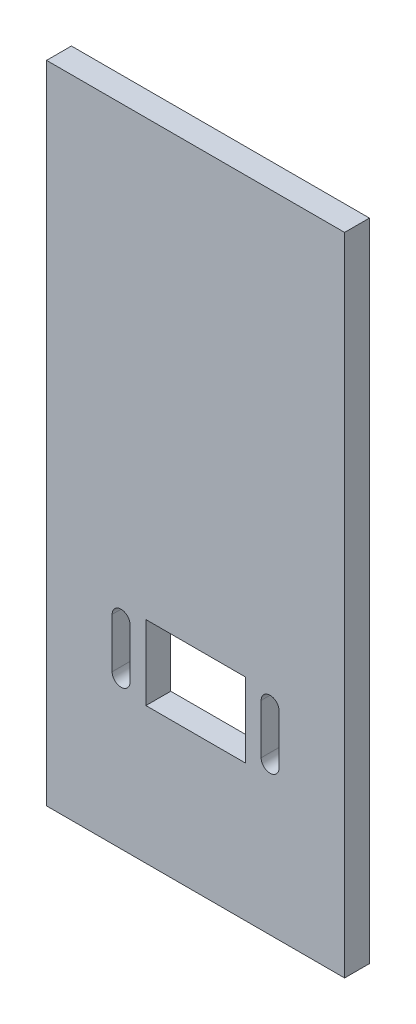
from build123d import *

# Parameters (mm, degrees)
SKETCH1_W           = 60
SKETCH1_H           = 130
BOSS_EXTRUDE1_DEPTH = 5
SKETCH2_W           = 20
SKETCH2_H           = 15
CUT_EXTRUDE1_DEPTH  = 5
CUT_EXTRUDE2_DEPTH  = 5


with BuildPart() as part:
    # Sketch1 → Boss-Extrude1 (new body)
    with BuildSketch(Plane.XY):
        Rectangle(SKETCH1_W, SKETCH1_H)
    extrude(amount=BOSS_EXTRUDE1_DEPTH)

    # Sketch2 → Cut-Extrude1 (cut)
    with BuildSketch(Plane(origin=(0, 0, 0), x_dir=(-1, 0, 0), z_dir=(0, 0, -1))):
        with Locations((0, -30)):
            Rectangle(SKETCH2_W, SKETCH2_H)
    extrude(amount=-CUT_EXTRUDE1_DEPTH, mode=Mode.SUBTRACT)

    # Sketch3 → Cut-Extrude2 (cut)
    with BuildSketch(Plane(origin=(0, 0, 0), x_dir=(-1, 0, 0), z_dir=(0, 0, -1))):
        with BuildLine():
            Line((16.8, -25), (16.8, -35))
            ThreePointArc((16.8, -35), (15, -36.8), (13.2, -35))
            Line((13.2, -35), (13.2, -25))
            ThreePointArc((13.2, -25), (15, -23.2), (16.8, -25))
        make_face()
        with BuildLine():
            Line((-13.2, -25), (-13.2, -35))
            ThreePointArc((-13.2, -35), (-15, -36.8), (-16.8, -35))
            Line((-16.8, -35), (-16.8, -25))
            ThreePointArc((-16.8, -25), (-15, -23.2), (-13.2, -25))
        make_face()
    extrude(amount=-CUT_EXTRUDE2_DEPTH, mode=Mode.SUBTRACT)


solid = part.part
